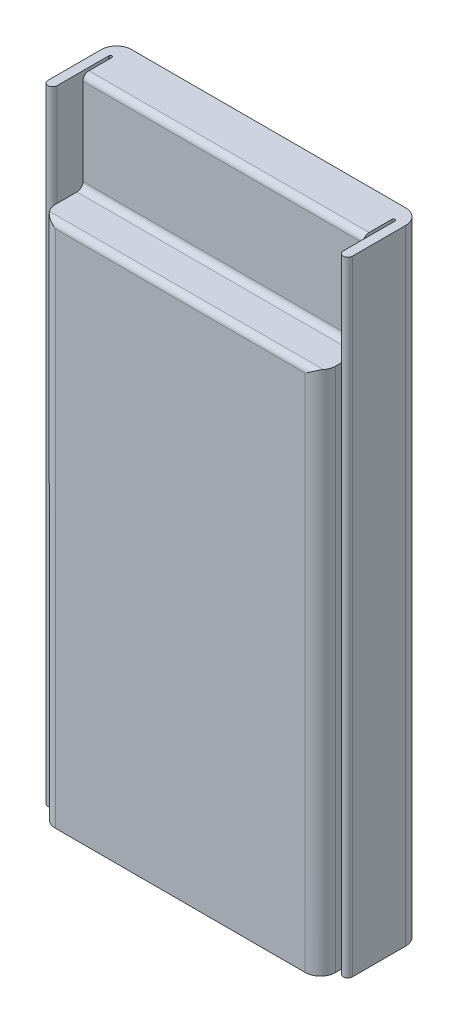
from build123d import *

# Parameters (mm, degrees)
EXTRUDE_1_DEPTH                 = 20.5
CUT_EXTRUDE_1_REACH             = 25.535
CUT_EXTRUDE_1_DIRECTION_2_REACH = 25.535


with BuildPart() as part:
    # Эскиз1 → Бобышка-Вытянуть1 (new, symmetric)
    with BuildSketch(Plane(origin=(0, 0, 0), x_dir=(1, 0, 0), z_dir=(0, 1, 0))):
        with BuildLine():
            Line((-9, 0), (9, 0))
            ThreePointArc((9, 0), (9.707106781, -0.292893219), (10, -1))
            Line((10, -1), (10, -4.5))
            ThreePointArc((10, -4.5), (9.7, -4.8), (9.4, -4.5))
            Line((9.4, -4.5), (9.4, -1.1))
            ThreePointArc((9.4, -1.1), (9.3, -1), (9.2, -1.1))
            Line((9.2, -1.1), (9.2, -4.8))
            ThreePointArc((9.2, -4.8), (8.907106781, -5.507106781), (8.2, -5.8))
            Line((8.2, -5.8), (-8.2, -5.8))
            ThreePointArc((-8.2, -5.8), (-8.907106781, -5.507106781), (-9.2, -4.8))
            Line((-9.2, -4.8), (-9.2, -1.1))
            ThreePointArc((-9.2, -1.1), (-9.3, -1), (-9.4, -1.1))
            Line((-9.4, -1.1), (-9.4, -4.5))
            ThreePointArc((-9.4, -4.5), (-9.7, -4.8), (-10, -4.5))
            Line((-10, -4.5), (-10, -1))
            ThreePointArc((-10, -1), (-9.707106781, -0.292893219), (-9, 0))
        make_face()
    extrude(amount=EXTRUDE_1_DEPTH, both=True)

    # Эскиз2 → Вырез-Вытянуть1 (cut, up to next)
    with BuildSketch(Plane(origin=(0, 0, 0), x_dir=(0, 0, -1), z_dir=(1, 0, 0)), mode=Mode.PRIVATE) as cut_extrude_1_sk1:
        with BuildLine():
            Line((-3, 20.1), (-3, 14.4))
            ThreePointArc((-3, 14.4), (-3.117157288, 14.117157288), (-3.4, 14))
            Line((-3.4, 14), (-5.4, 14))
            ThreePointArc((-5.4, 14), (-5.682842712, 13.882842712), (-5.8, 13.6))
            Line((-5.8, 13.6), (-5.8, 20.5))
            Line((-5.8, 20.5), (-2.6, 20.5))
            ThreePointArc((-2.6, 20.5), (-2.882842712, 20.382842712), (-3, 20.1))
        make_face()
    cut_extrude_1_tool1 = extrude(cut_extrude_1_sk1.sketch, amount=-CUT_EXTRUDE_1_REACH, mode=Mode.PRIVATE) & part.part
    add(cut_extrude_1_tool1.solids().sort_by_distance((0, 17.255615, 4.402132))[0], mode=Mode.SUBTRACT)

    # Эскиз2 → Вырез-Вытянуть1 direction 2 (cut, up to next)
    with BuildSketch(Plane(origin=(0, 0, 0), x_dir=(0, 0, -1), z_dir=(1, 0, 0)), mode=Mode.PRIVATE) as cut_extrude_1_direction_2_sk1:
        with BuildLine():
            Line((-3, 20.1), (-3, 14.4))
            ThreePointArc((-3, 14.4), (-3.117157288, 14.117157288), (-3.4, 14))
            Line((-3.4, 14), (-5.4, 14))
            ThreePointArc((-5.4, 14), (-5.682842712, 13.882842712), (-5.8, 13.6))
            Line((-5.8, 13.6), (-5.8, 20.5))
            Line((-5.8, 20.5), (-2.6, 20.5))
            ThreePointArc((-2.6, 20.5), (-2.882842712, 20.382842712), (-3, 20.1))
        make_face()
    cut_extrude_1_direction_2_tool1 = extrude(cut_extrude_1_direction_2_sk1.sketch, amount=CUT_EXTRUDE_1_DIRECTION_2_REACH, mode=Mode.PRIVATE) & part.part
    add(cut_extrude_1_direction_2_tool1.solids().sort_by_distance((0, 17.255615, 4.402132))[0], mode=Mode.SUBTRACT)


solid = part.part
